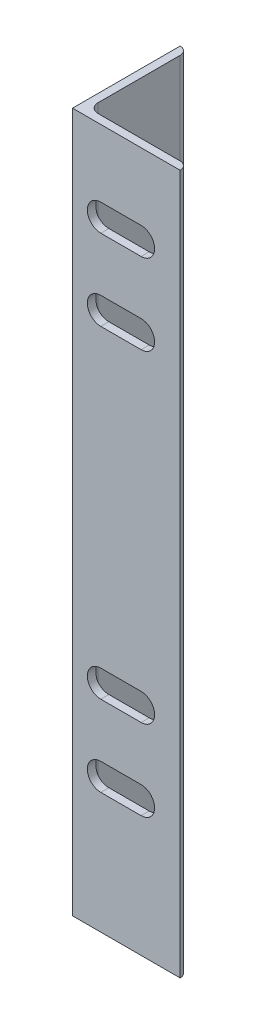
from build123d import *

# Parameters (mm, degrees)
IRON_V40X40X3_1_DEPTH = 260
CUT_EXTRUDE1_DEPTH    = 10


with BuildPart() as part:
    # Sketch1 → Iron V40X40X3(1) (new body)
    with BuildSketch(Plane(origin=(0, 0, 0), x_dir=(1, 0, 0), z_dir=(0, 1, 0))):
        with BuildLine():
            Line((0, 0), (0, 40))
            ThreePointArc((0, 40), (2.121320344, 39.121320344), (3, 37))
            Line((3, 37), (3, 6.5))
            ThreePointArc((3, 6.5), (4.025126266, 4.025126266), (6.5, 3))
            Line((6.5, 3), (37, 3))
            ThreePointArc((37, 3), (39.121320344, 2.121320344), (40, 0))
            Line((40, 0), (0, 0))
        make_face()
    extrude(amount=IRON_V40X40X3_1_DEPTH)

    # Sketch2 → Cut-Extrude1 (cut)
    with BuildSketch(Plane.XY):
        with BuildLine():
            Line((10.5, 55), (25.5, 55))
            ThreePointArc((25.5, 55), (30.5, 50), (25.5, 45))
            Line((25.5, 45), (10.5, 45))
            ThreePointArc((10.5, 45), (5.5, 50), (10.5, 55))
        make_face()
        with BuildLine():
            Line((10.5, 85), (25.5, 85))
            ThreePointArc((25.5, 85), (30.5, 80), (25.5, 75))
            Line((25.5, 75), (10.5, 75))
            ThreePointArc((10.5, 75), (5.5, 80), (10.5, 85))
        make_face()
        with BuildLine():
            Line((10.5, 205), (25.5, 205))
            ThreePointArc((25.5, 205), (30.5, 200), (25.5, 195))
            Line((25.5, 195), (10.5, 195))
            ThreePointArc((10.5, 195), (5.5, 200), (10.5, 205))
        make_face()
        with BuildLine():
            Line((10.5, 235), (25.5, 235))
            ThreePointArc((25.5, 235), (30.5, 230), (25.5, 225))
            Line((25.5, 225), (10.5, 225))
            ThreePointArc((10.5, 225), (5.5, 230), (10.5, 235))
        make_face()
    extrude(amount=-CUT_EXTRUDE1_DEPTH, mode=Mode.SUBTRACT)


solid = part.part
